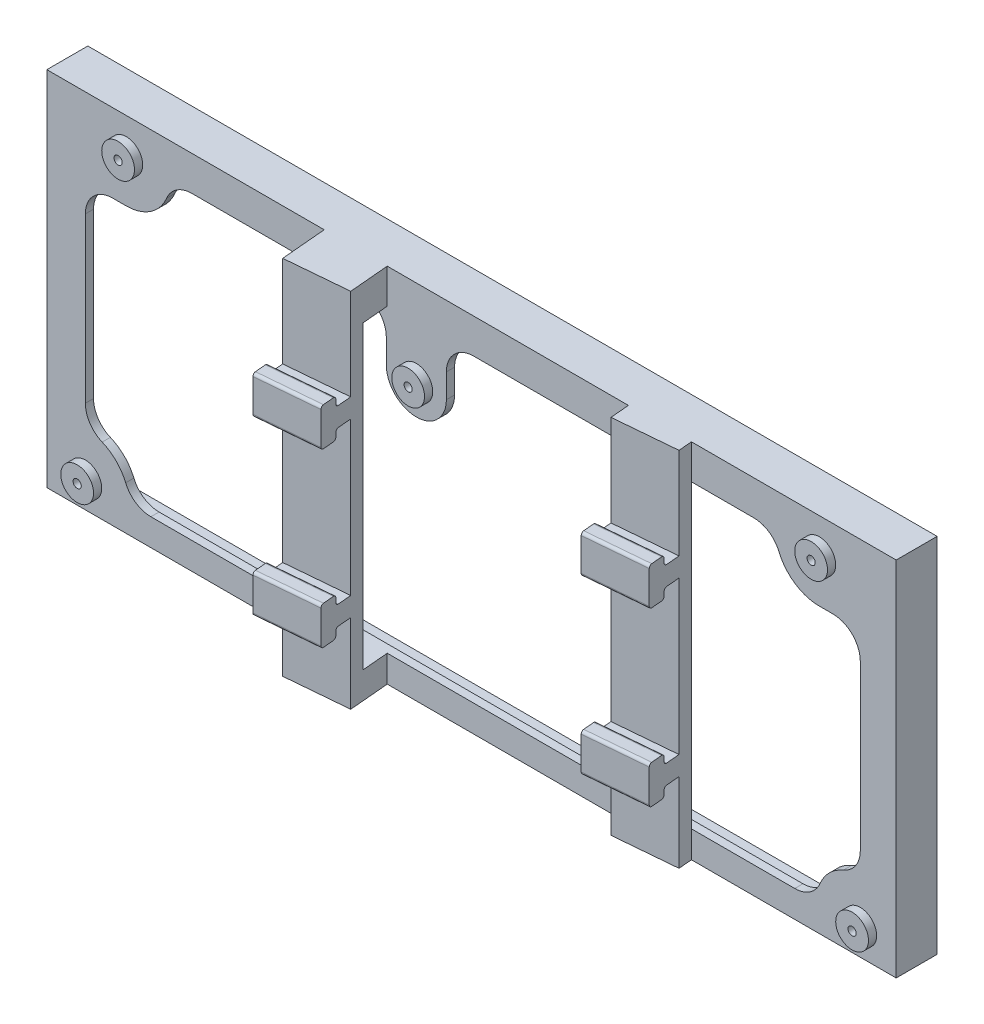
from build123d import *

# Parameters (mm, degrees)
SKETCH1_R                                     = 6
SKETCH1_R_2                                   = 1.5
DISPLAY_SCREW_PATTERN_DEPTH                   = 3
DISPLAY_SCREW_PATTERN_2_DEPTH                 = 3
DISPLAY_SCREW_PATTERN_3_DEPTH                 = 3
DISPLAY_SCREW_PATTERN_4_DEPTH                 = 3
DISPLAY_SCREW_PATTERN_5_DEPTH                 = 3
SKETCH2_W                                     = 311.1
SKETCH2_H                                     = 132.6
SKETCH2_R                                     = 4
DISPLAY_BACKPLANE_DEPTH                       = 3
BACKPLANE_WEIGHT_REDUCTION_DEPTH              = 203.770122306
BACKPLANE_WEIGHT_REDUCTION_DEPTH_BACK         = 203.770122306
SKETCH4_W                                     = 311.1
SKETCH4_H                                     = 132.6
SKETCH4_W_2                                   = 309.1
SKETCH4_H_2                                   = 130.6
DISPLAY_OUTSIDE_CRADDLE_DEPTH                 = 12
SKETCH7_W                                     = 132.6
SKETCH7_H                                     = 23
SLOT_INTERFACE_BACKING_BLOCK_DEPTH            = 5
SLOT_INTERFACE_BACKING_BLOCK_2_DEPTH          = 5
SLOT_BACKING_CONNECTION_REACH                 = 205.475
SKETCH8_W                                     = 23
SKETCH8_H                                     = 12.7
SKETCH8_H_2                                   = 9.82
SLOTS_RIGHT_IGNORE_SW_AXES_IN_THIS_PART_DEPTH = 23
SLOTS_LEFT_DEPTH                              = 23


with BuildPart() as part:
    # Sketch1 → Display screw pattern (new body)
    with BuildSketch(Plane.XY):
        Circle(SKETCH1_R)
        Circle(SKETCH1_R_2, mode=Mode.SUBTRACT)
    extrude(amount=DISPLAY_SCREW_PATTERN_DEPTH)



with BuildPart() as body_2:
    # Sketch1 → Display screw pattern 2 (new body)
    with BuildSketch(Plane.XY):
        with Locations((-106.24, 18.83)):
            Circle(SKETCH1_R)
        with Locations((-106.24, 18.83)):
            Circle(SKETCH1_R_2, mode=Mode.SUBTRACT)
    extrude(amount=DISPLAY_SCREW_PATTERN_2_DEPTH)


with BuildPart() as body_3:
    # Sketch1 → Display screw pattern 3 (new body)
    with BuildSketch(Plane.XY):
        with Locations((147.61, 18.83)):
            Circle(SKETCH1_R)
        with Locations((147.61, 18.83)):
            Circle(SKETCH1_R_2, mode=Mode.SUBTRACT)
    extrude(amount=DISPLAY_SCREW_PATTERN_3_DEPTH)


with BuildPart() as body_4:
    # Sketch1 → Display screw pattern 4 (new body)
    with BuildSketch(Plane.XY):
        with Locations((-121.24, -91.25)):
            Circle(SKETCH1_R)
        with Locations((-121.24, -91.25)):
            Circle(SKETCH1_R_2, mode=Mode.SUBTRACT)
    extrude(amount=DISPLAY_SCREW_PATTERN_4_DEPTH)


with BuildPart() as body_5:
    # Sketch1 → Display screw pattern 5 (new body)
    with BuildSketch(Plane.XY):
        with Locations((162.61, -91.25)):
            Circle(SKETCH1_R)
        with Locations((162.61, -91.25)):
            Circle(SKETCH1_R_2, mode=Mode.SUBTRACT)
    extrude(amount=DISPLAY_SCREW_PATTERN_5_DEPTH)


with BuildPart() as part_1:
    add(part.part)

    add(body_2.part)  # Display backplane merges body 2

    add(body_3.part)  # Display backplane merges body 3

    add(body_4.part)  # Display backplane merges body 4

    add(body_5.part)  # Display backplane merges body 5
    # Sketch2 → Display backplane (add)
    with BuildSketch(Plane(origin=(0, 0, 0), x_dir=(-1, 0, 0), z_dir=(0, 0, -1))):
        with Locations((-20.21, -34.77)):
            Rectangle(SKETCH2_W, SKETCH2_H)
        with Locations((106.24, 18.83)):
            Circle(SKETCH2_R, mode=Mode.SUBTRACT)
        Circle(SKETCH2_R, mode=Mode.SUBTRACT)
        with Locations((121.24, -91.25)):
            Circle(SKETCH2_R, mode=Mode.SUBTRACT)
        with Locations((-147.61, 18.83)):
            Circle(SKETCH2_R, mode=Mode.SUBTRACT)
        with Locations((-162.61, -91.25)):
            Circle(SKETCH2_R, mode=Mode.SUBTRACT)
    extrude(amount=DISPLAY_BACKPLANE_DEPTH)

    # Sketch3 → Backplane weight reduction (cut, two sides: drawn at the far end of the back side and taken through both)
    with BuildSketch(Plane.XY.offset(-BACKPLANE_WEIGHT_REDUCTION_DEPTH_BACK)):
        with BuildLine():
            Line((162.61, -7.17), (162.61, -67.25))
            ThreePointArc((162.61, -67.25), (160.930502943, -72.797001962), (156.456153846, -76.480769231))
            ThreePointArc((156.456153846, -76.480769231), (151.296291501, -79.936291501), (147.840769231, -85.096153846))
            ThreePointArc((147.840769231, -85.096153846), (144.157001962, -89.570502943), (138.61, -91.25))
            Line((138.61, -91.25), (-97.24, -91.25))
            ThreePointArc((-97.24, -91.25), (-102.787001962, -89.570502943), (-106.470769231, -85.096153846))
            ThreePointArc((-106.470769231, -85.096153846), (-109.926291501, -79.936291501), (-115.086153846, -76.480769231))
            ThreePointArc((-115.086153846, -76.480769231), (-119.560502943, -72.797001962), (-121.24, -67.25))
            Line((-121.24, -67.25), (-121.24, -7.17))
            ThreePointArc((-121.24, -7.17), (-118.311067812, -0.098932188), (-111.24, 2.83))
            Line((-111.24, 2.83), (-106.24, 2.83))
            ThreePointArc((-106.24, 2.83), (-97.36479686, 5.517195291), (-91.470769231, 12.676153846))
            ThreePointArc((-91.470769231, 12.676153846), (-87.787001962, 17.150502943), (-82.24, 18.83))
            Line((-82.24, 18.83), (-21, 18.83))
            ThreePointArc((-21, 18.83), (-13.928932188, 15.901067812), (-11, 8.83))
            Line((-11, 8.83), (-11, 0))
            ThreePointArc((-11, 0), (0, -11), (11, 0))
            Line((11, 0), (11, 8.83))
            ThreePointArc((11, 8.83), (13.928932188, 15.901067812), (21, 18.83))
            Line((21, 18.83), (123.61, 18.83))
            ThreePointArc((123.61, 18.83), (129.157001962, 17.150502943), (132.840769231, 12.676153846))
            ThreePointArc((132.840769231, 12.676153846), (138.73479686, 5.517195291), (147.61, 2.83))
            Line((147.61, 2.83), (152.61, 2.83))
            ThreePointArc((152.61, 2.83), (159.681067812, -0.098932188), (162.61, -7.17))
        make_face()
    extrude(amount=BACKPLANE_WEIGHT_REDUCTION_DEPTH + BACKPLANE_WEIGHT_REDUCTION_DEPTH_BACK, mode=Mode.SUBTRACT)

    # Sketch4 → Display outside craddle (add)
    with BuildSketch(Plane(origin=(0, 0, -3), x_dir=(-1, 0, 0), z_dir=(0, 0, -1))):
        with Locations((-20.21, -34.77)):
            Rectangle(SKETCH4_W, SKETCH4_H)
        with Locations((-20.21, -34.77)):
            Rectangle(SKETCH4_W_2, SKETCH4_H_2, mode=Mode.SUBTRACT)
    extrude(amount=DISPLAY_OUTSIDE_CRADDLE_DEPTH)

    # Sketch8 → Slot backing connection (add, up to next)
    with BuildSketch(Plane(origin=(0.765385403, 0, 8.748395191), x_dir=(-0.9961946980917455, 0, 0.08715574274765839), z_dir=(-0.08715574274765839, 0, -0.9961946980917455)), mode=Mode.PRIVATE) as slot_backing_connection_sk1:
        with Locations((-88.87657778, 25.18)):
            Rectangle(SKETCH8_W, SKETCH8_H)
    slot_backing_connection_tool1 = extrude(slot_backing_connection_sk1.sketch, amount=SLOT_BACKING_CONNECTION_REACH, mode=Mode.PRIVATE) - part_1.part
    # Sketch8 → Slot backing connection (add, up to next)
    with BuildSketch(Plane(origin=(0.765385403, 0, 8.748395191), x_dir=(-0.9961946980917455, 0, 0.08715574274765839), z_dir=(-0.08715574274765839, 0, -0.9961946980917455)), mode=Mode.PRIVATE) as slot_backing_connection_sk2:
        with Locations((-88.87657778, -96.16)):
            Rectangle(SKETCH8_W, SKETCH8_H_2)
    slot_backing_connection_tool2 = extrude(slot_backing_connection_sk2.sketch, amount=SLOT_BACKING_CONNECTION_REACH, mode=Mode.PRIVATE) - part_1.part
    # Sketch8 → Slot backing connection (add, up to next)
    with BuildSketch(Plane(origin=(0.765385403, 0, 8.748395191), x_dir=(-0.9961946980917455, 0, 0.08715574274765839), z_dir=(-0.08715574274765839, 0, -0.9961946980917455)), mode=Mode.PRIVATE) as slot_backing_connection_sk3:
        with Locations((22.12342222, 25.18)):
            Rectangle(SKETCH8_W, SKETCH8_H)
    slot_backing_connection_tool3 = extrude(slot_backing_connection_sk3.sketch, amount=SLOT_BACKING_CONNECTION_REACH, mode=Mode.PRIVATE) - part_1.part
    # Sketch8 → Slot backing connection (add, up to next)
    with BuildSketch(Plane(origin=(0.765385403, 0, 8.748395191), x_dir=(-0.9961946980917455, 0, 0.08715574274765839), z_dir=(-0.08715574274765839, 0, -0.9961946980917455)), mode=Mode.PRIVATE) as slot_backing_connection_sk4:
        with Locations((22.12342222, -96.16)):
            Rectangle(SKETCH8_W, SKETCH8_H_2)
    slot_backing_connection_tool4 = extrude(slot_backing_connection_sk4.sketch, amount=SLOT_BACKING_CONNECTION_REACH, mode=Mode.PRIVATE) - part_1.part


with BuildPart() as body_2_2:
    # Sketch7 → Slot interface backing block (new body)
    with BuildSketch(Plane(origin=(0.765385403, 0, 8.748395191), x_dir=(0, -1, 0), z_dir=(0.08715574274765836, 0, 0.9961946980917455))):
        with Locations((34.77, 88.87657778)):
            Rectangle(SKETCH7_W, SKETCH7_H)
    extrude(amount=SLOT_INTERFACE_BACKING_BLOCK_DEPTH)


with BuildPart() as body_3_2:
    # Sketch7 → Slot interface backing block 2 (new body)
    with BuildSketch(Plane(origin=(0.765385403, 0, 8.748395191), x_dir=(0, -1, 0), z_dir=(0.08715574274765836, 0, 0.9961946980917455))):
        with Locations((34.77, -22.12342222)):
            Rectangle(SKETCH7_W, SKETCH7_H)
    extrude(amount=SLOT_INTERFACE_BACKING_BLOCK_2_DEPTH)


with BuildPart() as part_2:
    add(part_1.part)

    add(body_2_2.part)  # Slot backing connection merges body 2 2

    add(body_3_2.part)  # Slot backing connection merges body 3 2
    add(slot_backing_connection_tool1.solids().sort_by_distance((89.303761, 25.18, 1.002291))[0])
    add(slot_backing_connection_tool2.solids().sort_by_distance((89.303761, -96.16, 1.002291))[0])
    add(slot_backing_connection_tool3.solids().sort_by_distance((-21.273851, 25.18, 10.676578))[0])
    add(slot_backing_connection_tool4.solids().sort_by_distance((-21.273851, -96.16, 10.676578))[0])

    # Sketch9 → Slots right (ignore SW axes in this part) (add)
    with BuildSketch(Plane(origin=(-33.495474948, 0, 2.930474337), x_dir=(0.08715574274765839, 0, 0.9961946980917455), z_dir=(-0.9961946980917455, 0, 0.08715574274765839))):
        with BuildLine():
            Line((13.781812639, -1.97), (18.781812639, -1.97))
            ThreePointArc((18.781812639, -1.97), (19.48891942, -1.677106781), (19.781812639, -0.97))
            Line((19.781812639, -0.97), (19.781812639, 0.53))
            ThreePointArc((19.781812639, 0.53), (20.074705858, 1.237106781), (20.781812639, 1.53))
            Line((20.781812639, 1.53), (24.781812639, 1.53))
            ThreePointArc((24.781812639, 1.53), (25.48891942, 1.237106781), (25.781812639, 0.53))
            Line((25.781812639, 0.53), (25.781812639, -11.47))
            ThreePointArc((25.781812639, -11.47), (25.48891942, -12.177106781), (24.781812639, -12.47))
            Line((24.781812639, -12.47), (20.781812639, -12.47))
            ThreePointArc((20.781812639, -12.47), (20.074705858, -12.177106781), (19.781812639, -11.47))
            Line((19.781812639, -11.47), (19.781812639, -9.97))
            ThreePointArc((19.781812639, -9.97), (19.48891942, -9.262893219), (18.781812639, -8.97))
            Line((18.781812639, -8.97), (13.781812639, -8.97))
            Line((13.781812639, -8.97), (13.781812639, -1.97))
        make_face()
        with BuildLine():
            Line((13.781812639, -71.97), (13.781812639, -64.97))
            Line((13.781812639, -64.97), (18.781812639, -64.97))
            ThreePointArc((18.781812639, -64.97), (19.48891942, -64.677106781), (19.781812639, -63.97))
            Line((19.781812639, -63.97), (19.781812639, -62.47))
            ThreePointArc((19.781812639, -62.47), (20.074705858, -61.762893219), (20.781812639, -61.47))
            Line((20.781812639, -61.47), (24.781812639, -61.47))
            ThreePointArc((24.781812639, -61.47), (25.48891942, -61.762893219), (25.781812639, -62.47))
            Line((25.781812639, -62.47), (25.781812639, -74.47))
            ThreePointArc((25.781812639, -74.47), (25.48891942, -75.177106781), (24.781812639, -75.47))
            Line((24.781812639, -75.47), (20.781812639, -75.47))
            ThreePointArc((20.781812639, -75.47), (20.074705858, -75.177106781), (19.781812639, -74.47))
            Line((19.781812639, -74.47), (19.781812639, -72.97))
            ThreePointArc((19.781812639, -72.97), (19.48891942, -72.262893219), (18.781812639, -71.97))
            Line((18.781812639, -71.97), (13.781812639, -71.97))
        make_face()
    extrude(amount=-SLOTS_RIGHT_IGNORE_SW_AXES_IN_THIS_PART_DEPTH)

    # Sketch10 → Slots left (add)
    with BuildSketch(Plane(origin=(77.082136541, 0, -6.743813108), x_dir=(0.08715574274765839, 0, 0.9961946980917455), z_dir=(-0.9961946980917455, 0, 0.08715574274765839))):
        with BuildLine():
            Line((19.781812639, 0.53), (19.781812639, -0.97))
            ThreePointArc((19.781812639, -0.97), (19.48891942, -1.677106781), (18.781812639, -1.97))
            Line((18.781812639, -1.97), (13.781812639, -1.97))
            Line((13.781812639, -1.97), (13.781812639, -8.97))
            Line((13.781812639, -8.97), (18.781812639, -8.97))
            ThreePointArc((18.781812639, -8.97), (19.48891942, -9.262893219), (19.781812639, -9.97))
            Line((19.781812639, -9.97), (19.781812639, -11.47))
            ThreePointArc((19.781812639, -11.47), (20.074705858, -12.177106781), (20.781812639, -12.47))
            Line((20.781812639, -12.47), (24.781812639, -12.47))
            ThreePointArc((24.781812639, -12.47), (25.48891942, -12.177106781), (25.781812639, -11.47))
            Line((25.781812639, -11.47), (25.781812639, 0.53))
            ThreePointArc((25.781812639, 0.53), (25.48891942, 1.237106781), (24.781812639, 1.53))
            Line((24.781812639, 1.53), (20.781812639, 1.53))
            ThreePointArc((20.781812639, 1.53), (20.074705858, 1.237106781), (19.781812639, 0.53))
        make_face()
        with BuildLine():
            Line((19.781812639, -62.47), (19.781812639, -63.97))
            ThreePointArc((19.781812639, -63.97), (19.48891942, -64.677106781), (18.781812639, -64.97))
            Line((18.781812639, -64.97), (13.781812639, -64.97))
            Line((13.781812639, -64.97), (13.781812639, -71.97))
            Line((13.781812639, -71.97), (18.781812639, -71.97))
            ThreePointArc((18.781812639, -71.97), (19.48891942, -72.262893219), (19.781812639, -72.97))
            Line((19.781812639, -72.97), (19.781812639, -74.47))
            ThreePointArc((19.781812639, -74.47), (20.074705858, -75.177106781), (20.781812639, -75.47))
            Line((20.781812639, -75.47), (24.781812639, -75.47))
            ThreePointArc((24.781812639, -75.47), (25.48891942, -75.177106781), (25.781812639, -74.47))
            Line((25.781812639, -74.47), (25.781812639, -62.47))
            ThreePointArc((25.781812639, -62.47), (25.48891942, -61.762893219), (24.781812639, -61.47))
            Line((24.781812639, -61.47), (20.781812639, -61.47))
            ThreePointArc((20.781812639, -61.47), (20.074705858, -61.762893219), (19.781812639, -62.47))
        make_face()
    extrude(amount=-SLOTS_LEFT_DEPTH)


solid = part_2.part
